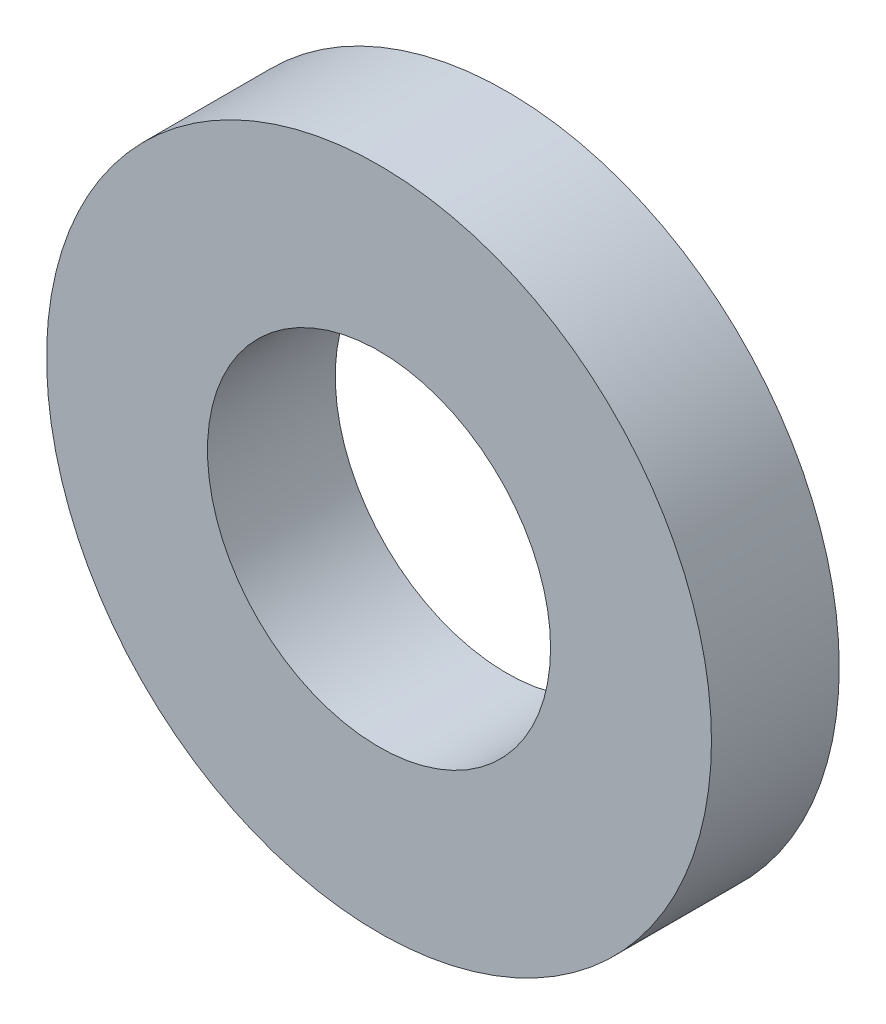
from build123d import *

# Parameters (mm, degrees)
SKETCH1_R      = 7.1374
SKETCH1_R_2    = 3.683
EXTRUDE1_DEPTH = 2.7432


with BuildPart() as part:
    # Sketch1 → Extrude1 (new body)
    with BuildSketch(Plane.XY):
        Circle(SKETCH1_R)
        Circle(SKETCH1_R_2, mode=Mode.SUBTRACT)
    extrude(amount=-EXTRUDE1_DEPTH)


solid = part.part
